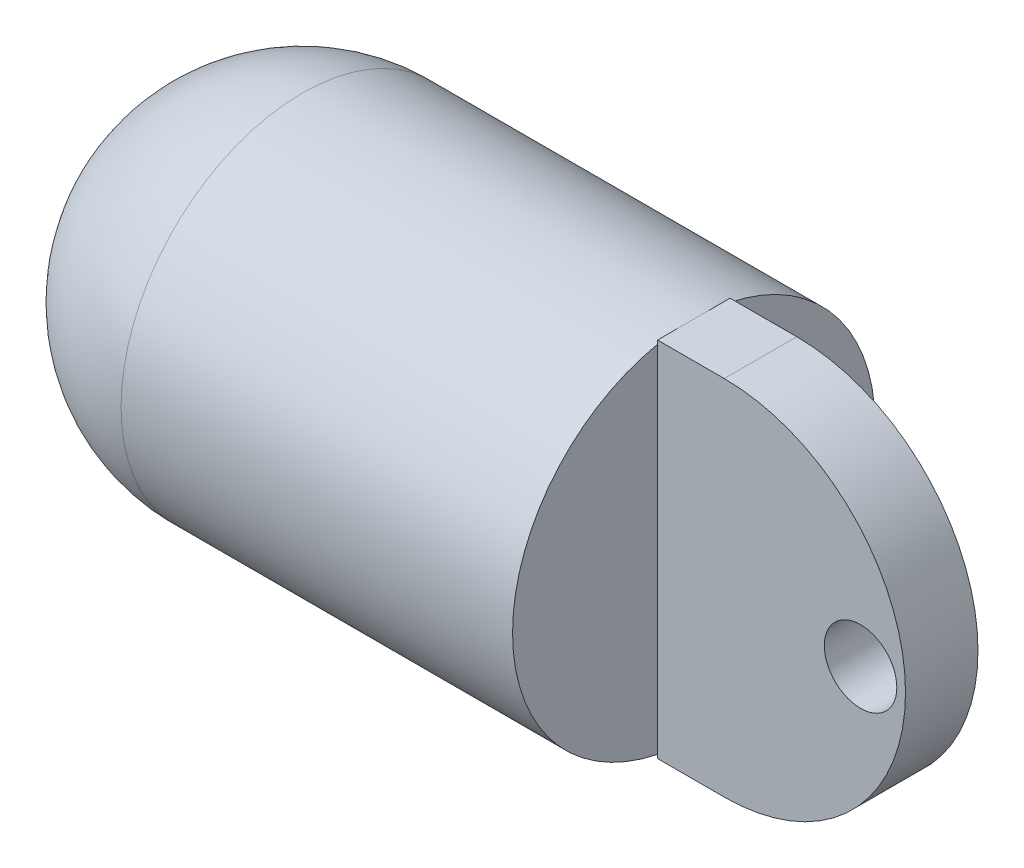
from build123d import *

# Parameters (mm, degrees)
SKETCH1_R               = 12.5
BOSS_EXTRUDE1_DEPTH     = 27
SKETCH6_W               = 5
SKETCH6_H               = 25
BOSS_EXTRUDE3_DEPTH     = 4.6
BOSS_EXTRUDE4_DEPTH     = 5
CUT_EXTRUDE1_DEPTH      = 34.320414163
CUT_EXTRUDE1_DEPTH_BACK = 34.320414163
SKETCH10_R              = 2.5
REVOLVE1_ANGLE          = 180


with BuildPart() as part:
    # Sketch1 → Boss-Extrude1 (new body)
    with BuildSketch(Plane(origin=(0, 0, 0), x_dir=(0, 0, -1), z_dir=(1, 0, 0))):
        Circle(SKETCH1_R)
    extrude(amount=-BOSS_EXTRUDE1_DEPTH)

    # Sketch6 → Boss-Extrude3 (add)
    with BuildSketch(Plane(origin=(0, 0, 0), x_dir=(0, 0, -1), z_dir=(1, 0, 0))):
        Rectangle(SKETCH6_W, SKETCH6_H)
    extrude(amount=BOSS_EXTRUDE3_DEPTH)

    # Sketch8 → Boss-Extrude4 (add)
    with BuildSketch(Plane.XY.offset(2.5)):
        with BuildLine():
            Line((4.6, 12.5), (4.6, -12.5))
            ThreePointArc((4.6, -12.5), (17.1, 0), (4.6, 12.5))
        make_face()
    extrude(amount=-BOSS_EXTRUDE4_DEPTH)

    # Sketch10 → Cut-Extrude1 (cut, two sides: drawn at the far end of the back side and taken through both)
    with BuildSketch(Plane.XY.offset(2.5).offset(-CUT_EXTRUDE1_DEPTH_BACK)):
        with Locations(Location((14, 0, 0), (0, 0, 270))):
            Circle(SKETCH10_R)
    extrude(amount=CUT_EXTRUDE1_DEPTH + CUT_EXTRUDE1_DEPTH_BACK, mode=Mode.SUBTRACT)

    # Sketch11 → Revolve1 (revolve)
    with BuildSketch(Plane.ZY.offset(27)):
        with BuildLine():
            Line((0, 12.5), (0, -12.5))
            ThreePointArc((0, -12.5), (12.5, 0), (0, 12.5))
        make_face()
    revolve(axis=Axis((-27, 12.5, 0), (0, -1, 0)), revolution_arc=REVOLVE1_ANGLE)


solid = part.part
